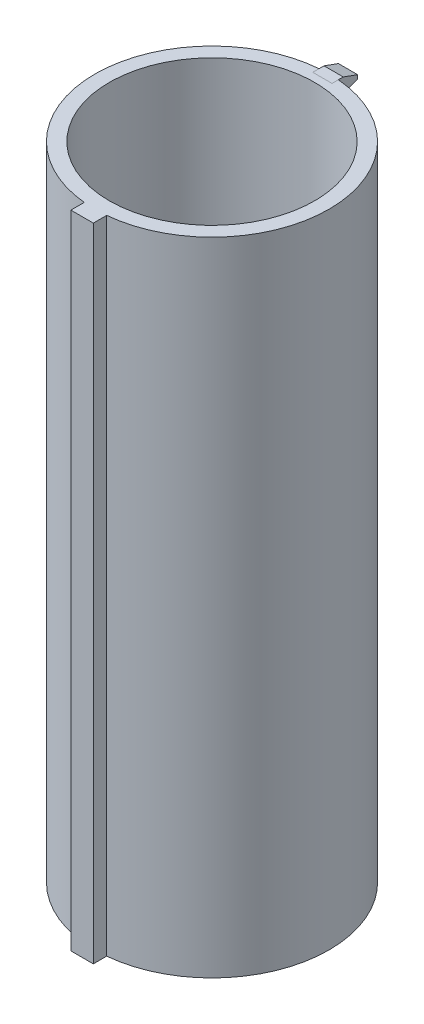
from build123d import *

# Parameters (mm, degrees)
SKETCH_1_R                     = 18.25
SKETCH_1_R_2                   = 16
EXTRUDE_1_DEPTH                = 100
EXTRUDE_2_DEPTH                = 1.5
EXTRUDE_2_DEPTH_BACK           = 1.5
SKETCH_5_W                     = 3.5
SKETCH_5_H                     = 4
EXTRUDE_4_DEPTH                = 100
SPLIT_BODIES_2_SURFACE_1_BACK  = 115.24
SPLIT_BODIES_2_SURFACE_1_DEPTH = 230.48
SPLIT_BODIES_2_SURFACE_2_BACK  = 115.24
SPLIT_BODIES_2_SURFACE_2_DEPTH = 230.48


with BuildPart() as part:
    # Эскиз1 → Бобышка-Вытянуть1 (new body)
    with BuildSketch(Plane(origin=(0, 0, 0), x_dir=(1, 0, 0), z_dir=(0, 1, 0))):
        with Locations(Location((0, 0, 0), (0, 0, 270))):
            Circle(SKETCH_1_R)
        with Locations(Location((0, 0, 0), (0, 0, 270))):
            Circle(SKETCH_1_R_2, mode=Mode.SUBTRACT)
    extrude(amount=EXTRUDE_1_DEPTH)

    # Эскиз3 → Бобышка-Вытянуть2 (add, two sides: drawn at the far end of the back side and taken through both)
    with BuildSketch(Plane(origin=(0, 0, 0), x_dir=(0, 0, -1), z_dir=(1, 0, 0)).offset(-EXTRUDE_2_DEPTH_BACK)):
        Polygon((21.205212662, 96.041066973), (18.955212662, 96.86), (18.955212662, 97.747278089), (21.205212662, 98.566211116), (21.205212662, 99.181066973), (18.955212662, 100), (17.205212662, 100), (17.205212662, 0), (18.955212662, 0), (18.955212662, 2.65840735), (18.955212662, 3.547278089), (21.205212662, 4.366211116), (21.205212662, 4.981066973), (18.955212662, 5.8), (18.955212662, 6.687278089), (21.205212662, 7.506211116), (21.205212662, 8.121066973), (18.955212662, 8.94), (18.955212662, 9.827278089), (21.205212662, 10.646211116), (21.205212662, 11.261066973), (18.955212662, 12.08), (18.955212662, 12.967278089), (21.205212662, 13.786211116), (21.205212662, 14.401066973), (18.955212662, 15.22), (18.955212662, 16.107278089), (21.205212662, 16.926211116), (21.205212662, 17.541066973), (18.955212662, 18.36), (18.955212662, 19.247278089), (21.205212662, 20.066211116), (21.205212662, 20.681066973), (18.955212662, 21.5), (18.955212662, 22.387278089), (21.205212662, 23.206211116), (21.205212662, 23.821066973), (18.955212662, 24.64), (18.955212662, 25.527278089), (21.205212662, 26.346211116), (21.205212662, 26.961066973), (18.955212662, 27.78), (18.955212662, 28.667278089), (21.205212662, 29.486211116), (21.205212662, 30.101066973), (18.955212662, 30.92), (18.955212662, 31.807278089), (21.205212662, 32.626211116), (21.205212662, 33.241066973), (18.955212662, 34.06), (18.955212662, 34.947278089), (21.205212662, 35.766211116), (21.205212662, 36.381066973), (18.955212662, 37.2), (18.955212662, 38.087278089), (21.205212662, 38.906211116), (21.205212662, 39.521066973), (18.955212662, 40.34), (18.955212662, 41.227278089), (21.205212662, 42.046211116), (21.205212662, 42.661066973), (18.955212662, 43.48), (18.955212662, 44.367278089), (21.205212662, 45.186211116), (21.205212662, 45.801066973), (18.955212662, 46.62), (18.955212662, 47.507278089), (21.205212662, 48.326211116), (21.205212662, 48.941066973), (18.955212662, 49.76), (18.955212662, 50.647278089), (21.205212662, 51.466211116), (21.205212662, 52.081066973), (18.955212662, 52.9), (18.955212662, 53.787278089), (21.205212662, 54.606211116), (21.205212662, 55.221066973), (18.955212662, 56.04), (18.955212662, 56.927278089), (21.205212662, 57.746211116), (21.205212662, 58.361066973), (18.955212662, 59.18), (18.955212662, 60.067278089), (21.205212662, 60.886211116), (21.205212662, 61.501066973), (18.955212662, 62.32), (18.955212662, 63.207278089), (21.205212662, 64.026211116), (21.205212662, 64.641066973), (18.955212662, 65.46), (18.955212662, 66.347278089), (21.205212662, 67.166211116), (21.205212662, 67.781066973), (18.955212662, 68.6), (18.955212662, 69.487278089), (21.205212662, 70.306211116), (21.205212662, 70.921066973), (18.955212662, 71.74), (18.955212662, 72.627278089), (21.205212662, 73.446211116), (21.205212662, 74.061066973), (18.955212662, 74.88), (18.955212662, 75.767278089), (21.205212662, 76.586211116), (21.205212662, 77.201066973), (18.955212662, 78.02), (18.955212662, 78.907278089), (21.205212662, 79.726211116), (21.205212662, 80.341066973), (18.955212662, 81.16), (18.955212662, 82.047278089), (21.205212662, 82.866211116), (21.205212662, 83.481066973), (18.955212662, 84.3), (18.955212662, 85.187278089), (21.205212662, 86.006211116), (21.205212662, 86.621066973), (18.955212662, 87.44), (18.955212662, 88.327278089), (21.205212662, 89.146211116), (21.205212662, 89.761066973), (18.955212662, 90.58), (18.955212662, 91.467278089), (21.205212662, 92.286211116), (21.205212662, 92.901066973), (18.955212662, 93.72), (18.955212662, 94.607278089), (21.205212662, 95.426211116), align=None)
    extrude(amount=EXTRUDE_2_DEPTH + EXTRUDE_2_DEPTH_BACK)

    # Эскиз5 → Бобышка-Вытянуть4 (add)
    with BuildSketch(Plane.XZ):
        with Locations((0, 18.25)):
            Rectangle(SKETCH_5_W, SKETCH_5_H)
    extrude(amount=-EXTRUDE_4_DEPTH)


with BuildPart() as body_2:
    # Split Bodies 2: the piece behind the surface
    add(part.part)
    # Split Bodies 2 surface: a surface, the sketch's curves swept straight by 230.48 mm
    with BuildLine(Plane(origin=(0, 100, 0), x_dir=(1, 0, 0), z_dir=(0, 1, 0)).offset(-SPLIT_BODIES_2_SURFACE_1_BACK), mode=Mode.PRIVATE) as split_bodies_2_surface_1_path:
        Line((1.5, 21.205212662), (1.5, 17.205212662))
        Line((1.5, 17.205212662), (-1.5, 17.205212662))
        Line((-1.5, 17.205212662), (-1.5, 21.205212662))
    split_bodies_2_surface_1 = Shell.extrude(split_bodies_2_surface_1_path.wire(), (0 * SPLIT_BODIES_2_SURFACE_1_DEPTH, 1 * SPLIT_BODIES_2_SURFACE_1_DEPTH, 0 * SPLIT_BODIES_2_SURFACE_1_DEPTH))
    split(bisect_by=split_bodies_2_surface_1, keep=Keep.BOTTOM)


with BuildPart() as part_1:
    add(part.part)

    # Split Bodies 2: split by a surface, the side it looks to stays
    # Split Bodies 2 surface: a surface, the sketch's curves swept straight by 230.48 mm
    with BuildLine(Plane(origin=(0, 100, 0), x_dir=(1, 0, 0), z_dir=(0, 1, 0)).offset(-SPLIT_BODIES_2_SURFACE_2_BACK), mode=Mode.PRIVATE) as split_bodies_2_surface_2_path:
        Line((1.5, 21.205212662), (1.5, 17.205212662))
        Line((1.5, 17.205212662), (-1.5, 17.205212662))
        Line((-1.5, 17.205212662), (-1.5, 21.205212662))
    split_bodies_2_surface_2 = Shell.extrude(split_bodies_2_surface_2_path.wire(), (0 * SPLIT_BODIES_2_SURFACE_2_DEPTH, 1 * SPLIT_BODIES_2_SURFACE_2_DEPTH, 0 * SPLIT_BODIES_2_SURFACE_2_DEPTH))
    split(bisect_by=split_bodies_2_surface_2, keep=Keep.TOP)


solid = Compound([body_2.part, part_1.part])
